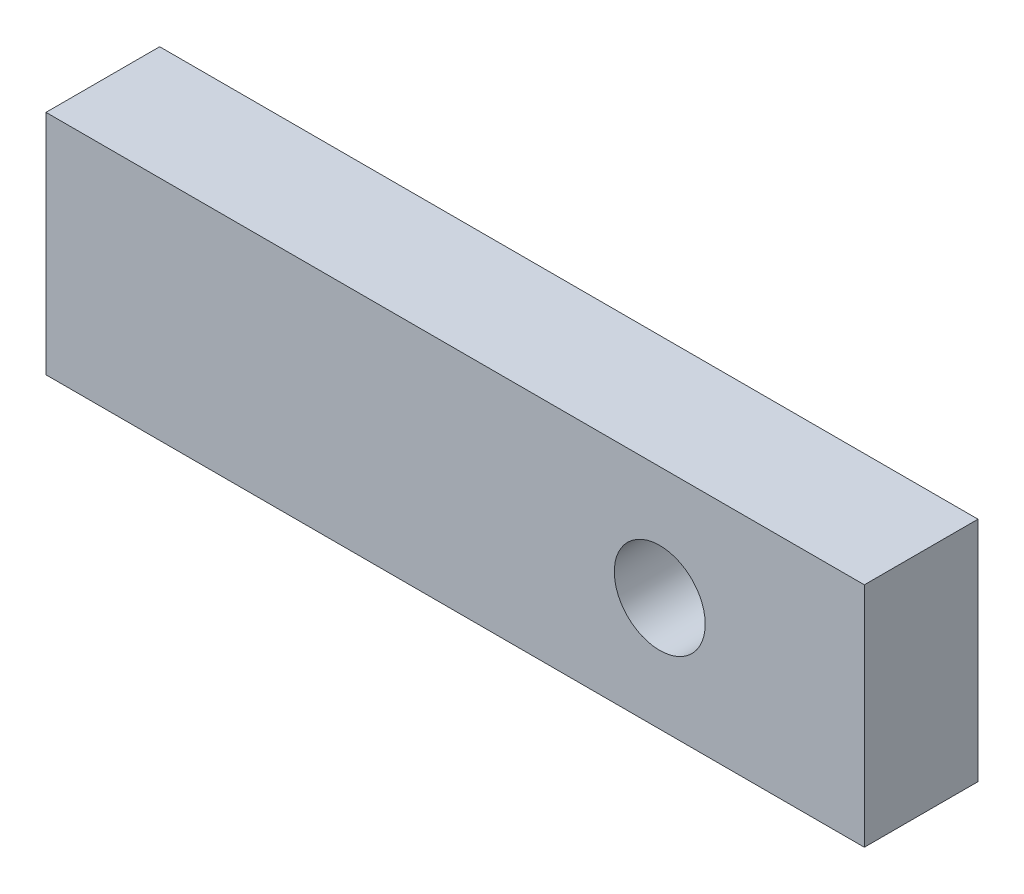
from build123d import *

# Parameters (mm, degrees)
SKETCH1_W           = 18
SKETCH1_H           = 2.5
BOSS_EXTRUDE1_DEPTH = 5
SKETCH2_R           = 1
CUT_EXTRUDE1_DEPTH  = 2.5


with BuildPart() as part:
    # Sketch1 → Boss-Extrude1 (new body)
    with BuildSketch(Plane(origin=(0, 0, 0), x_dir=(1, 0, 0), z_dir=(0, 1, 0))):
        with Locations((0, 1.25)):
            Rectangle(SKETCH1_W, SKETCH1_H)
    extrude(amount=BOSS_EXTRUDE1_DEPTH)

    # Sketch2 → Cut-Extrude1 (cut)
    with BuildSketch(Plane.XY):
        with Locations((4.5, 2.5)):
            Circle(SKETCH2_R)
    extrude(amount=-CUT_EXTRUDE1_DEPTH, mode=Mode.SUBTRACT)


solid = part.part
